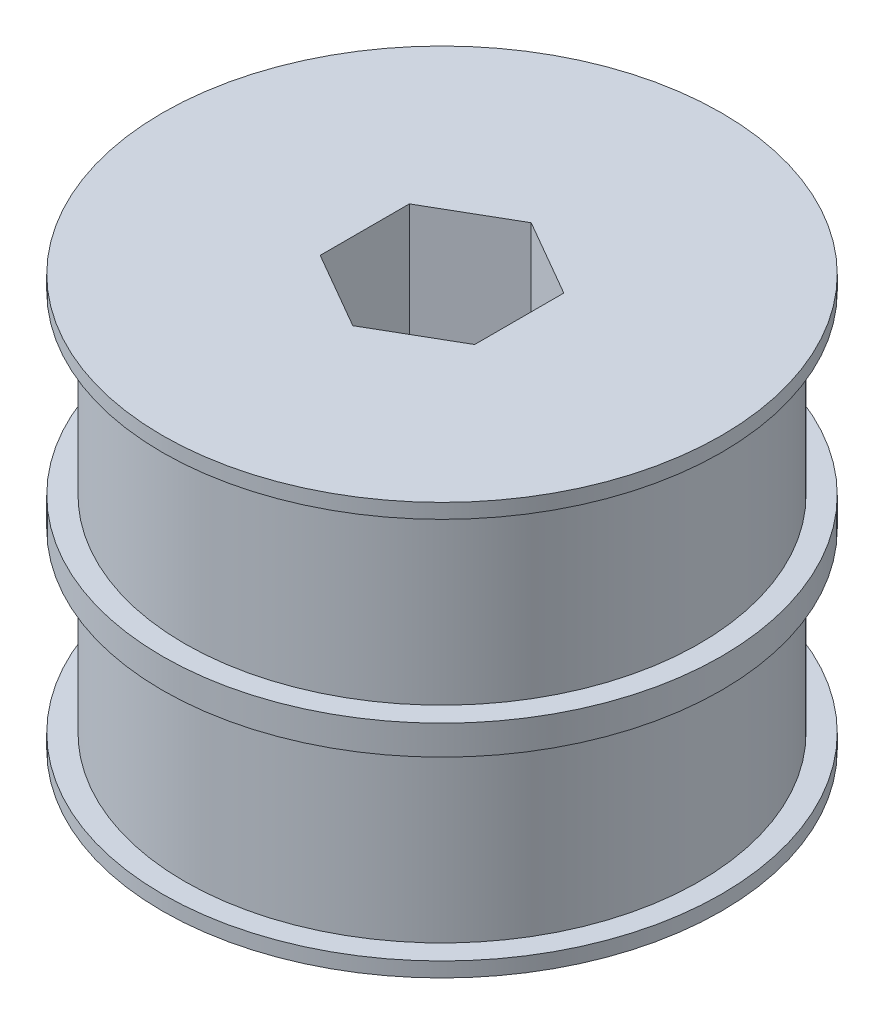
from build123d import *

# Parameters (mm, degrees)
SKETCH1_R           = 24.13
BOSS_EXTRUDE1_DEPTH = 17.78
SKETCH2_W           = 3.81
SKETCH2_H           = 15.24


with BuildPart() as part:
    # Sketch1 → Boss-Extrude1 (new, symmetric)
    with BuildSketch(Plane(origin=(0, 0, 0), x_dir=(1, 0, 0), z_dir=(0, 1, 0))):
        Circle(SKETCH1_R)
        Polygon((-6.6675, 3.84948292), (0, 7.69896584), (2.709533295, 6.134616063), (6.6675, 3.84948292), (6.6675, -3.84948292), (0, -7.69896584), (-6.6675, -3.84948292), align=None, mode=Mode.SUBTRACT)
    extrude(amount=BOSS_EXTRUDE1_DEPTH, both=True)

    # Sketch2 → Cut-Revolve1 (revolve, cut)
    with BuildSketch(Plane.XY):
        with Locations((-24.13, -8.89)):
            Rectangle(SKETCH2_W, SKETCH2_H)
        with Locations((-24.13, 8.89)):
            Rectangle(SKETCH2_W, SKETCH2_H)
    revolve(axis=Axis((0, 17.78, 0), (0, -1, 0)), mode=Mode.SUBTRACT)


solid = part.part
